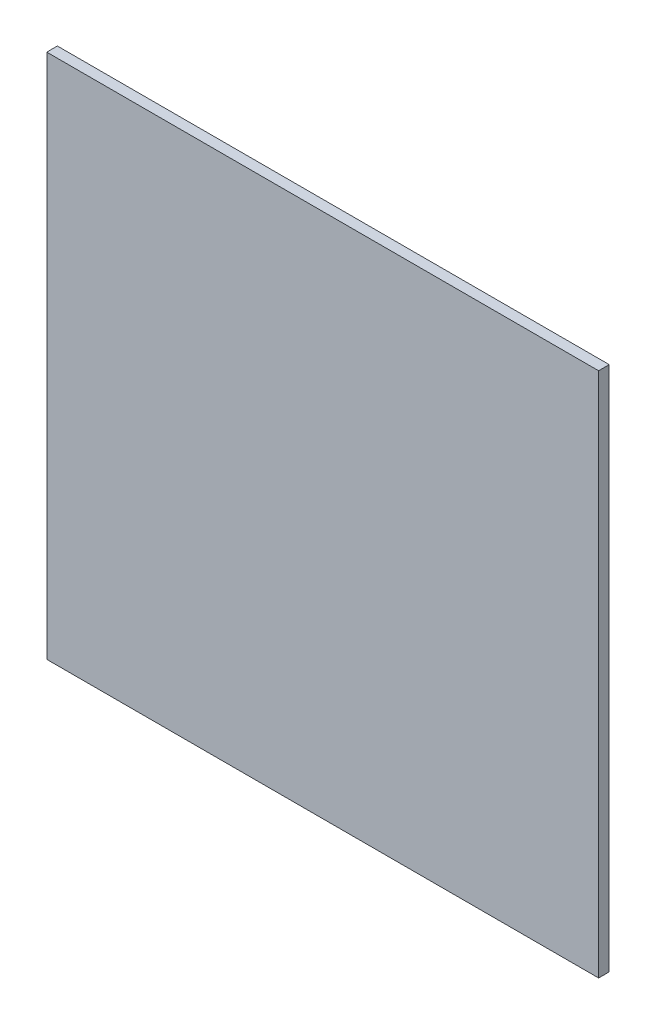
from build123d import *

# Parameters (mm, degrees)
ESQUISSE1_W        = 156
ESQUISSE1_H        = 148.66
BOSS_EXTRU_1_DEPTH = 3


with BuildPart() as part:
    # Esquisse1 → Boss.-Extru.1 (new body)
    with BuildSketch(Plane.XY):
        with Locations((0, -5.291798743)):
            Rectangle(ESQUISSE1_W, ESQUISSE1_H)
    extrude(amount=BOSS_EXTRU_1_DEPTH)


solid = part.part
